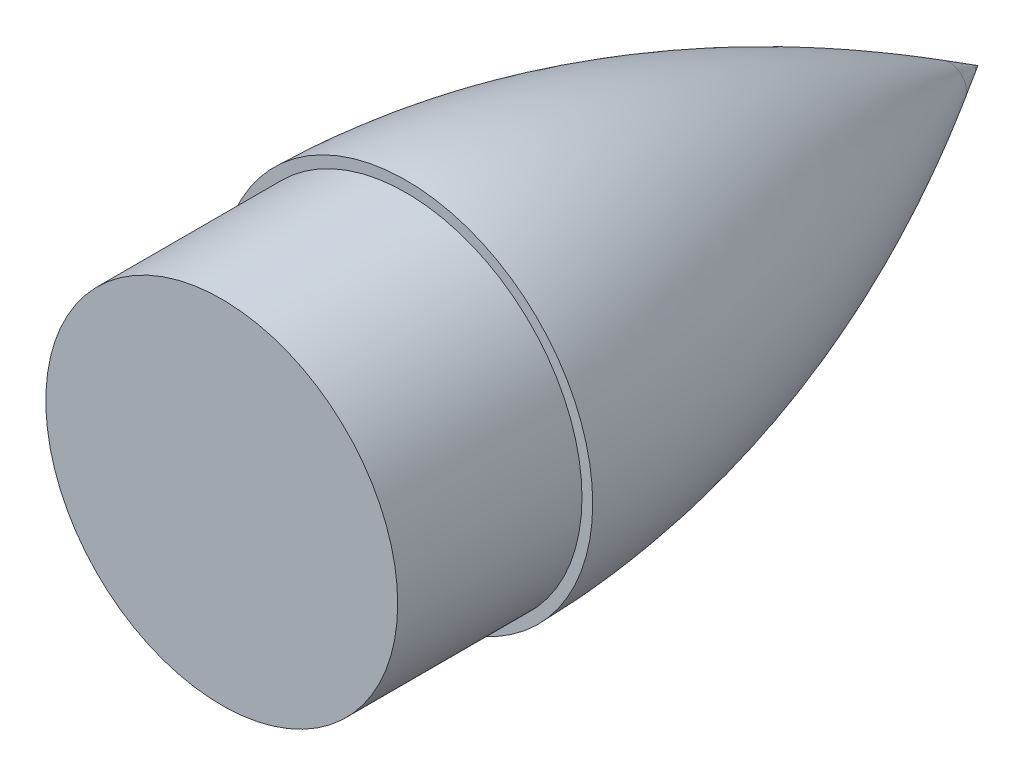
from build123d import *


with BuildPart() as part:
    # Эскиз1 → Повернуть1 (revolve)
    with BuildSketch(Plane(origin=(0, 0, 0), x_dir=(1, 0, 0), z_dir=(0, 1, 0)), mode=Mode.PRIVATE) as revolve_1_sk:
        with BuildLine():
            Line((-21, -18), (-21, -20))
            Line((-21, -20), (-17.766039573, -20))
            Line((-17.766039573, -20), (0, -20))
            Line((0, -20), (0, 70.269421294))
            Line((0, 70.269421294), (-2, 66.894778154))
            add(Edge.make_bspline(
                [(-22.279618173, 2), (-22.225979802, 4.652467696), (-21.922543341, 9.933456513), (-20.526163589, 20.595541154), (-17.945044177, 31.339758467), (-14.172786226, 42.18677282), (-10.747822672, 50.369210535), (-7.391998069, 57.234794572), (-4.414967739, 62.739623462), (-2.813230638, 65.522596558), (-2, 66.894778154)],
                knots=[0.025818282, 0.025818282, 0.025818282, 0.025818282, 0.138042672, 0.250267061, 0.474715841, 0.586940231, 0.699164621, 0.811389011, 0.867501205, 0.9236134, 0.9236134, 0.9236134, 0.9236134], degree=3))
            Line((-22.279618173, 2), (-21, 2))
            Line((-21, 2), (-21, -18))
        make_face()
    revolve(revolve_1_sk.sketch.rotate(Axis((0, 0, 20), (0, 0, -1)), 180), axis=Axis((0, 0, 20), (0, 0, -1)))


solid = part.part
